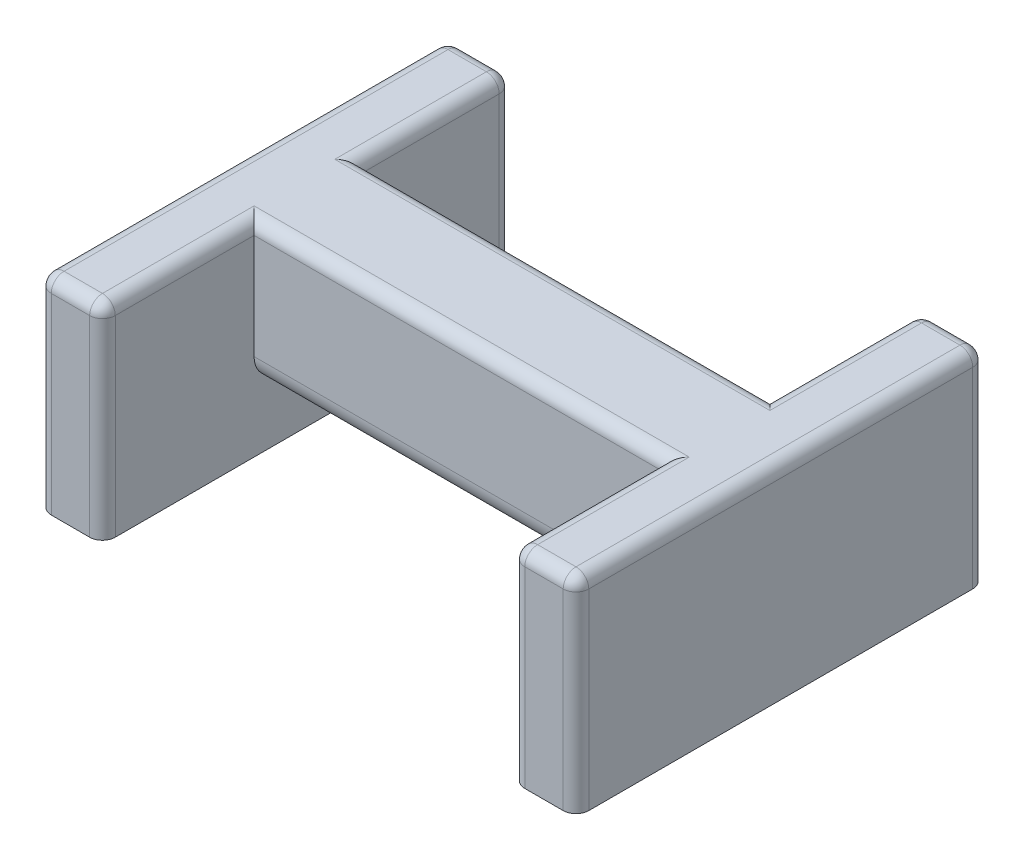
from build123d import *

# Parameters (mm, degrees)
SKETCH1_W           = 32
SKETCH1_H           = 8.3
BOSS_EXTRUDE1_DEPTH = 11.2
SKETCH2_W           = 8.3
SKETCH2_H           = 11.2
BOSS_EXTRUDE2_DEPTH = 5
SKETCH3_W           = 8.3
SKETCH3_H           = 11.2
BOSS_EXTRUDE3_DEPTH = 5
FILLET1_R           = 1
FILLET2_R           = 2
SKETCH4_R           = 1.4
CUT_EXTRUDE1_DEPTH  = 8


with BuildPart() as part:
    # Sketch1 → Boss-Extrude1 (new body)
    with BuildSketch(Plane(origin=(0, 0, 0), x_dir=(1, 0, 0), z_dir=(0, 1, 0))):
        Rectangle(SKETCH1_W, SKETCH1_H)
    extrude(amount=BOSS_EXTRUDE1_DEPTH)

    # Sketch2 → Boss-Extrude2 (add)
    with BuildSketch(Plane(origin=(16, 0, 0), x_dir=(0, 0, -1), z_dir=(1, 0, 0))):
        Polygon((-4.15, 11.2), (-16, 11.2), (-16, -4.8), (16, -4.8), (16, 11.2), (4.15, 11.2), (4.15, 0), (-4.15, 0), align=None)
        with Locations((0, 5.6)):
            Rectangle(SKETCH2_W, SKETCH2_H)
    extrude(amount=BOSS_EXTRUDE2_DEPTH)

    # Sketch3 → Boss-Extrude3 (add)
    with BuildSketch(Plane.ZY.offset(16)):
        Polygon((16, 11.2), (4.15, 11.2), (4.15, 0), (-4.15, 0), (-4.15, 11.2), (-16, 11.2), (-16, -4.8), (16, -4.8), align=None)
        with Locations((0, 5.6)):
            Rectangle(SKETCH3_W, SKETCH3_H)
    extrude(amount=BOSS_EXTRUDE3_DEPTH)

    # Fillet1
    fillet1_edges = [part.edges().sort_by_distance(p)[0] for p in [
        (21, 11.2, 0),
        (18.5, 11.2, -16),
        (16, 3.2, 16),
        (18.5, 11.2, 16),
        (21, 3.2, -16),
        (21, 3.2, 16),
        (16, 11.2, -10.075),
        (0, 11.2, 4.15),
        (16, 3.2, -16),
        (16, 11.2, 10.075),
        (-16, 11.2, 10.075),
        (-16, 11.2, -10.075),
        (-18.5, 11.2, 16),
        (-16, 3.2, -16),
        (-18.5, 11.2, -16),
        (-16, 3.2, 16),
        (-21, 11.2, 0),
        (-21, 3.2, -16),
        (-21, 3.2, 16),
        (0, 11.2, -4.15),
    ]]
    fillet(fillet1_edges, radius=FILLET1_R)

    # Fillet2
    fillet2_edges = [part.edges().sort_by_distance(p)[0] for p in [
        (0, 0, 4.15),
        (0, 0, -4.15),
    ]]
    fillet(fillet2_edges, radius=FILLET2_R)

    # Sketch4 → Cut-Extrude1 (cut)
    with BuildSketch(Plane.XZ.offset(4.8)):
        with Locations(Location((-18.5, 0, 0), (0, 0, 270))):
            Circle(SKETCH4_R)
        with Locations(Location((18.5, 0, 0), (0, 0, 270))):
            Circle(SKETCH4_R)
    extrude(amount=-CUT_EXTRUDE1_DEPTH, mode=Mode.SUBTRACT)


solid = part.part
